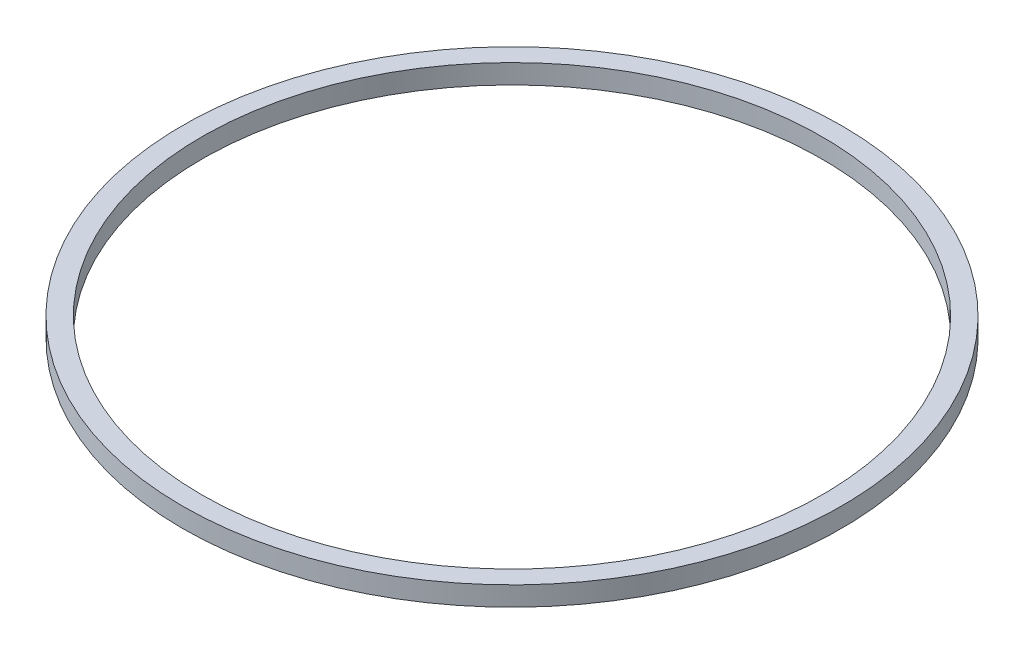
from build123d import *

# Parameters (mm, degrees)
SKETCH_1_R      = 170
SKETCH_1_R_2    = 160
EXTRUDE_1_DEPTH = 10


with BuildPart() as part:
    # 草图1 → 凸台-拉伸1 (new body)
    with BuildSketch(Plane(origin=(0, 0, 0), x_dir=(1, 0, 0), z_dir=(0, 1, 0))):
        with Locations(Location((0, 0, 0), (0, 0, 270))):
            Circle(SKETCH_1_R)
        with Locations(Location((0, 0, 0), (0, 0, 270))):
            Circle(SKETCH_1_R_2, mode=Mode.SUBTRACT)
    extrude(amount=EXTRUDE_1_DEPTH)


solid = part.part
